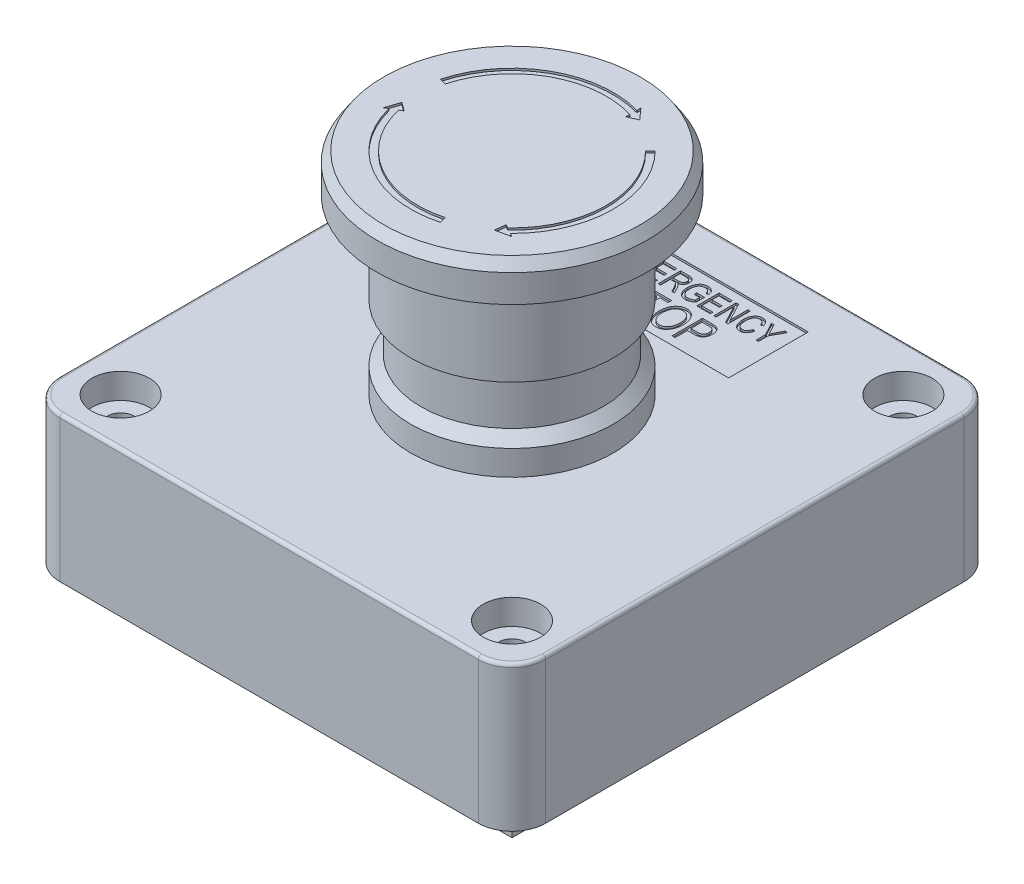
from build123d import *

# Parameters (mm, degrees)
SKETCH1_W               = 72
SKETCH1_H               = 72
BOSS_EXTRUDE1_DEPTH     = 21.5
FILLET1_R               = 5
CUT_EXTRUDE1_DEPTH      = 18.13
CUT_EXTRUDE2_DEPTH      = 56.265269383
CUT_EXTRUDE2_DEPTH_BACK = 56.265269383
SKETCH3_R               = 2
FILLET2_R               = 2
CUT_EXTRUDE3_DEPTH      = 56.265269383
CUT_EXTRUDE3_DEPTH_BACK = 0.3
SKETCH4_W               = 27.8
SKETCH4_H               = 11.8
CUT_EXTRUDE4_DEPTH      = 0.3
SKETCH8_R               = 4.25
CUT_EXTRUDE5_DEPTH      = 3.75
FILLET3_R               = 0.5
SKETCH9_R               = 12.5
BOSS_EXTRUDE2_DEPTH     = 10
BOSS_EXTRUDE3_DEPTH     = 6
SKETCH11_W              = 27
SKETCH11_H              = 27
BOSS_EXTRUDE4_DEPTH     = 24
CUT_EXTRUDE6_DEPTH      = 0.3


with BuildPart() as part:
    # Sketch1 → Boss-Extrude1 (new body)
    with BuildSketch(Plane(origin=(0, 0, 0), x_dir=(1, 0, 0), z_dir=(0, 1, 0))):
        Rectangle(SKETCH1_W, SKETCH1_H)
    extrude(amount=BOSS_EXTRUDE1_DEPTH)

    # Fillet1
    fillet1_edges = [part.edges().sort_by_distance(p)[0] for p in [
        (36, 10.75, 36),
        (-36, 10.75, 36),
        (-36, 10.75, -36),
        (36, 10.75, -36),
    ]]
    fillet(fillet1_edges, radius=FILLET1_R)

    # Sketch2 → Cut-Extrude1 (cut)
    with BuildSketch(Plane.XZ):
        Polygon((31, 12.3), (31, -16.4), (21.801694134, -26.5), (21.801694134, -31), (-21, -31), (-21, -13.290085662), (-31, -13.290085662), (-31, 15.409914338), (-20.9, 26.5), (-20.9, 31), (21, 31), (21, 12.3), align=None)
    extrude(amount=-CUT_EXTRUDE1_DEPTH, mode=Mode.SUBTRACT)

    # Sketch3 → Cut-Extrude2 (cut, two sides: drawn at the far end of the back side and taken through both)
    with BuildSketch(Plane(origin=(0, 21.5, 0), x_dir=(1, 0, 0), z_dir=(0, 1, 0)).offset(-CUT_EXTRUDE2_DEPTH_BACK)):
        with Locations(Location((-29, 29, 0), (0, 0, 270))):
            Circle(SKETCH3_R)
        with Locations(Location((29, 29, 0), (0, 0, 270))):
            Circle(SKETCH3_R)
        with Locations(Location((29, -29, 0), (0, 0, 270))):
            Circle(SKETCH3_R)
        with Locations(Location((-29, -29, 0), (0, 0, 270))):
            Circle(SKETCH3_R)
    extrude(amount=CUT_EXTRUDE2_DEPTH + CUT_EXTRUDE2_DEPTH_BACK, mode=Mode.SUBTRACT)

    # Fillet2
    fillet2_edges = [part.edges().sort_by_distance(p)[0] for p in [
        (21, 9.065, 12.3),
        (31, 9.065, 12.3),
        (31, 9.065, -16.4),
        (21.801694134, 9.065, -26.5),
        (21.801694134, 9.065, -31),
        (-21, 9.065, -31),
        (-21, 9.065, -13.290085662),
        (-31, 9.065, -13.290085662),
        (-31, 9.065, 15.409914338),
        (-20.9, 9.065, 26.5),
        (-20.9, 9.065, 31),
        (21, 9.065, 31),
    ]]
    fillet(fillet2_edges, radius=FILLET2_R)

    # Sketch4 → Cut-Extrude3 (cut, two sides: drawn at the far end of the back side and taken through both)
    with BuildSketch(Plane(origin=(0, 21.5, 0), x_dir=(1, 0, 0), z_dir=(0, 1, 0)).offset(-CUT_EXTRUDE3_DEPTH_BACK)):
        with Locations((0, 24.1)):
            Rectangle(SKETCH4_W, SKETCH4_H)
    extrude(amount=CUT_EXTRUDE3_DEPTH + CUT_EXTRUDE3_DEPTH_BACK, mode=Mode.SUBTRACT)

    # Sketch6 → Revolve2 (revolve)
    with BuildSketch(Plane.XY, mode=Mode.PRIVATE) as revolve2_sk:
        Polygon((0, 52.8), (0, 47.2), (15, 47.2), (20, 47.2), (20, 51.3), (19, 52.8), align=None)
        Polygon((0, 47.2), (0, 33.7), (13.5, 33.7), (15, 33.7), (15, 47.2), align=None)
        Polygon((0, 33.7), (0, 21.5), (15, 21.5), (15, 25.2), (13.5, 26.7), (13.5, 33.7), align=None)
    revolve(revolve2_sk.sketch.rotate(Axis((0, 0, 0), (0, 1, 0)), 90), axis=Axis((0, 0, 0), (0, 1, 0)))

    # Sketch7 → Cut-Extrude4 (cut)
    # profile 1 of 13: a face of its own
    with BuildSketch(Plane(origin=(0, 21.2, 0), x_dir=(1, 0, 0), z_dir=(0, 1, 0))):
        Polygon((-11.935714286, 25.386938867), (-11.935714286, 28.686938867), (-9.964285714, 28.686938867), (-9.964285714, 28.301224581), (-11.592857143, 28.301224581), (-11.592857143, 27.272653153), (-10.05, 27.272653153), (-10.05, 26.886938867), (-11.592857143, 26.886938867), (-11.592857143, 25.772653153), (-9.921428571, 25.772653153), (-9.921428571, 25.386938867), align=None)
    # profile 2 of 13: a face of its own
    with BuildSketch(Plane(origin=(0, 21.2, 0), x_dir=(1, 0, 0), z_dir=(0, 1, 0))):
        with BuildLine():
            Line((-9.407142857, 25.386938867), (-9.407142857, 28.686938867))
            Line((-9.407142857, 28.686938867), (-8.870758929, 28.686938867))
            Line((-8.870758929, 28.686938867), (-8.228571429, 26.350554938))
            Line((-8.228571429, 26.350554938), (-8.1, 25.861715653))
            add(Edge.make_bspline(
                [(-8.1, 25.861715653), (-8.09580599, 25.877799765), (-8.086993225, 25.911596892), (-8.072040154, 25.964887601), (-8.055168036, 26.023207661), (-8.038152733, 26.087058482), (-8.018507157, 26.155524866), (-7.996972068, 26.229089658), (-7.974241018, 26.308118688), (-7.958695008, 26.362605574), (-7.950669643, 26.39073351)],
                knots=[0, 0, 0, 0, 0.72569615, 1.52488642, 2.416426408, 3.376296137, 4.409732583, 5.526177123, 6.722930645, 8, 8, 8, 8], degree=3))
            Line((-7.950669643, 26.39073351), (-7.278348214, 28.686938867))
            Line((-7.278348214, 28.686938867), (-6.792857143, 28.686938867))
            Line((-6.792857143, 28.686938867), (-6.792857143, 25.386938867))
            Line((-6.792857143, 25.386938867), (-7.135714286, 25.386938867))
            Line((-7.135714286, 25.386938867), (-7.135714286, 28.11104601))
            Line((-7.135714286, 28.11104601), (-7.927901786, 25.386938867))
            Line((-7.927901786, 25.386938867), (-8.278794643, 25.386938867))
            Line((-8.278794643, 25.386938867), (-9.064285714, 28.267072795))
            Line((-9.064285714, 28.267072795), (-9.064285714, 25.386938867))
            Line((-9.064285714, 25.386938867), (-9.407142857, 25.386938867))
        make_face()
    # profile 3 of 13: a face of its own
    with BuildSketch(Plane(origin=(0, 21.2, 0), x_dir=(1, 0, 0), z_dir=(0, 1, 0))):
        Polygon((-6.235714286, 25.386938867), (-6.235714286, 28.686938867), (-4.264285714, 28.686938867), (-4.264285714, 28.301224581), (-5.892857143, 28.301224581), (-5.892857143, 27.272653153), (-4.35, 27.272653153), (-4.35, 26.886938867), (-5.892857143, 26.886938867), (-5.892857143, 25.772653153), (-4.221428571, 25.772653153), (-4.221428571, 25.386938867), align=None)
    # profile 4 of 13: a face of its own
    with BuildSketch(Plane(origin=(0, 21.2, 0), x_dir=(1, 0, 0), z_dir=(0, 1, 0))):
        with BuildLine():
            Line((-3.707142857, 25.386938867), (-3.707142857, 28.686938867))
            Line((-3.707142857, 28.686938867), (-2.495089286, 28.686938867))
            add(Edge.make_bspline(
                [(-2.495089286, 28.686938867), (-2.464501753, 28.686762801), (-2.405296434, 28.686422009), (-2.319528953, 28.68151951), (-2.239778603, 28.674262263), (-2.166151633, 28.664612953), (-2.099077856, 28.651235194), (-2.038291278, 28.635007012), (-1.983297374, 28.616892967), (-1.918736611, 28.587013686), (-1.845080961, 28.540667961), (-1.765643396, 28.470057906), (-1.696062565, 28.382616466), (-1.634145944, 28.282149706), (-1.583298101, 28.169349319), (-1.547280302, 28.046333646), (-1.525537065, 27.914718958), (-1.522821889, 27.8240774), (-1.521428571, 27.777563867)],
                knots=[0, 0, 0, 0, 0.957775898, 1.853873864, 2.6892683, 3.465319774, 4.178195347, 4.829309051, 5.435011313, 5.988660553, 7.053440284, 8.147710094, 9.30058322, 10.540256924, 11.835580405, 13.162637032, 14.543981594, 16, 16, 16, 16], degree=3))
            add(Edge.make_bspline(
                [(-1.521428571, 27.777563867), (-1.522157073, 27.74674054), (-1.523580063, 27.686532947), (-1.53220016, 27.598288282), (-1.547179898, 27.514583581), (-1.570088836, 27.435635435), (-1.596657587, 27.360462782), (-1.631545778, 27.290383354), (-1.671573329, 27.224492076), (-1.718096702, 27.163312675), (-1.770134804, 27.106981577), (-1.828536729, 27.056384235), (-1.892166907, 27.010802188), (-1.96152148, 26.970635671), (-2.036171216, 26.935370542), (-2.11699912, 26.907230465), (-2.202745471, 26.882587464), (-2.262389386, 26.871284276), (-2.292857143, 26.865510295)],
                knots=[0, 0, 0, 0, 1.121977975, 2.191573688, 3.224240956, 4.211948119, 5.180998842, 6.122125515, 7.055751929, 7.983633331, 8.914994346, 9.842128418, 10.791356962, 11.759862547, 12.75578979, 13.791489111, 14.871831714, 16, 16, 16, 16], degree=3))
            add(Edge.make_bspline(
                [(-2.292857143, 26.865510295), (-2.27036884, 26.853068063), (-2.227559839, 26.82938288), (-2.168974159, 26.791169106), (-2.118905971, 26.752705058), (-2.090601961, 26.724714292), (-2.077232143, 26.711492438)],
                knots=[0, 0, 0, 0, 1.158843086, 2.205987482, 3.152571606, 4, 4, 4, 4], degree=3))
            add(Edge.make_bspline(
                [(-2.077232143, 26.711492438), (-2.050490669, 26.679214406), (-1.996707016, 26.614295376), (-1.922978184, 26.510725204), (-1.852355677, 26.402983255), (-1.810882815, 26.327192348), (-1.789955357, 26.288947795)],
                knots=[0, 0, 0, 0, 0.982253192, 1.975551771, 2.978451105, 4, 4, 4, 4], degree=3))
            Line((-1.789955357, 26.288947795), (-1.307142857, 25.386938867))
            Line((-1.307142857, 25.386938867), (-1.696875, 25.386938867))
            Line((-1.696875, 25.386938867), (-2.077901786, 26.092742438))
            add(Edge.make_bspline(
                [(-2.077901786, 26.092742438), (-2.095651741, 26.125836639), (-2.129603168, 26.189137944), (-2.179990609, 26.279016463), (-2.226829263, 26.360073571), (-2.270040029, 26.432388323), (-2.310263275, 26.495193535), (-2.346389608, 26.549352239), (-2.379474614, 26.594247678), (-2.41907213, 26.640503539), (-2.465097809, 26.68845247), (-2.519811148, 26.736608226), (-2.574460942, 26.773939546), (-2.630101921, 26.802368554), (-2.691350689, 26.821096743), (-2.760365996, 26.835115033), (-2.840234942, 26.842739923), (-2.896860196, 26.843615529), (-2.927008929, 26.844081724)],
                knots=[0, 0, 0, 0, 1.483643366, 2.83785556, 4.070616892, 5.1822306, 6.165666296, 7.016844219, 7.754091418, 8.367230408, 9.421242841, 10.377779407, 11.241203819, 12.029974219, 12.835959019, 13.762973995, 14.808950166, 16, 16, 16, 16], degree=3))
            Line((-2.927008929, 26.844081724), (-3.364285714, 26.844081724))
            Line((-3.364285714, 26.844081724), (-3.364285714, 25.386938867))
            Line((-3.364285714, 25.386938867), (-3.707142857, 25.386938867))
        make_face()
        with BuildLine():
            Line((-3.364285714, 27.22979601), (-2.560044643, 27.22979601))
            add(Edge.make_bspline(
                [(-2.560044643, 27.22979601), (-2.518728517, 27.230600851), (-2.441298065, 27.232109203), (-2.332972886, 27.242126846), (-2.240514242, 27.260255003), (-2.162195096, 27.286657837), (-2.095411335, 27.321642485), (-2.037267321, 27.36496549), (-1.986267367, 27.416705634), (-1.942886459, 27.476552573), (-1.907017895, 27.543199354), (-1.882809512, 27.616463334), (-1.866377832, 27.694244172), (-1.864994442, 27.748010033), (-1.864285714, 27.775554938)],
                knots=[0, 0, 0, 0, 1.47306528, 2.760668081, 3.873497699, 4.82484281, 5.696997418, 6.550136397, 7.399890849, 8.276969651, 9.17766846, 10.086208714, 11.019541422, 12, 12, 12, 12], degree=3))
            add(Edge.make_bspline(
                [(-1.864285714, 27.775554938), (-1.864904699, 27.795434), (-1.866111427, 27.834188751), (-1.872460538, 27.890805742), (-1.884852127, 27.94408387), (-1.901202062, 27.994309438), (-1.923183601, 28.041023581), (-1.94885284, 28.084963685), (-1.981180283, 28.124323207), (-2.01636008, 28.16158492), (-2.057072873, 28.194664814), (-2.102538267, 28.223327798), (-2.152747097, 28.247405225), (-2.207217317, 28.268050622), (-2.267054473, 28.281783225), (-2.330856212, 28.293677123), (-2.399415651, 28.300271238), (-2.446639056, 28.300900305), (-2.470982143, 28.301224581)],
                knots=[0, 0, 0, 0, 1.045235731, 2.037714497, 2.988326782, 3.915852726, 4.808207886, 5.697550021, 6.58254782, 7.478674216, 8.387536059, 9.331464042, 10.296946822, 11.310355404, 12.385965615, 13.518246496, 14.720686494, 16, 16, 16, 16], degree=3))
            Line((-2.470982143, 28.301224581), (-3.364285714, 28.301224581))
            Line((-3.364285714, 28.301224581), (-3.364285714, 27.22979601))
        make_face(mode=Mode.SUBTRACT)
    # profile 5 of 13: a face of its own
    with BuildSketch(Plane(origin=(0, 21.2, 0), x_dir=(1, 0, 0), z_dir=(0, 1, 0))):
        with BuildLine():
            Line((0.321428571, 26.672653153), (0.321428571, 27.058367438))
            Line((0.321428571, 27.058367438), (1.478571429, 27.058367438))
            Line((1.478571429, 27.058367438), (1.478571429, 25.849662081))
            add(Edge.make_bspline(
                [(1.478571429, 25.849662081), (1.434566319, 25.809618699), (1.34844129, 25.731247405), (1.211176997, 25.62892434), (1.072205304, 25.540970046), (0.930778697, 25.469108967), (0.787151572, 25.412668127), (0.641414883, 25.37326008), (0.493458598, 25.348810078), (0.394065373, 25.345661481), (0.344196429, 25.344081724)],
                knots=[0, 0, 0, 0, 1.121144615, 2.194259096, 3.22291754, 4.218514423, 5.180530362, 6.126881594, 7.060193117, 8, 8, 8, 8], degree=3))
            add(Edge.make_bspline(
                [(0.344196429, 25.344081724), (0.311369437, 25.344844682), (0.246273277, 25.346357632), (0.149986288, 25.354779277), (0.056307974, 25.370513135), (-0.034569605, 25.391767634), (-0.122922923, 25.419120882), (-0.207978794, 25.453936757), (-0.291324343, 25.492847018), (-0.371005382, 25.53944554), (-0.447318379, 25.591589963), (-0.519760078, 25.64940555), (-0.588473512, 25.712302598), (-0.652212066, 25.781959928), (-0.712142908, 25.856829191), (-0.769024991, 25.936657995), (-0.820260228, 26.0230928), (-0.868714682, 26.11434823), (-0.911309802, 26.211298618), (-0.948322934, 26.313108942), (-0.979599264, 26.419618496), (-1.005836365, 26.530889376), (-1.025880188, 26.646956789), (-1.039561379, 26.767707305), (-1.048724436, 26.893047062), (-1.049569944, 26.978216668), (-1.05, 27.021537081)],
                knots=[0, 0, 0, 0, 0.963545397, 1.910717405, 2.833679837, 3.748938136, 4.648160849, 5.544707014, 6.44428759, 7.345417256, 8.250301349, 9.15471106, 10.063381295, 10.981308332, 11.922549023, 12.876762963, 13.855312354, 14.869185747, 15.907484256, 16.960251447, 18.046404778, 19.163470092, 20.313696906, 21.500864286, 22.728847097, 24, 24, 24, 24], degree=3))
            add(Edge.make_bspline(
                [(-1.05, 27.021537081), (-1.049551802, 27.065525007), (-1.048670412, 27.152028261), (-1.039741595, 27.279648488), (-1.025071261, 27.402771128), (-1.004869581, 27.521641273), (-0.979886467, 27.636563658), (-0.947434996, 27.746842107), (-0.910106927, 27.85290887), (-0.867036648, 27.954044305), (-0.819986506, 28.050156926), (-0.76824526, 28.139884843), (-0.713538378, 28.223497297), (-0.654135732, 28.299621122), (-0.592799106, 28.370656649), (-0.526899742, 28.434202556), (-0.457761799, 28.491686727), (-0.384384281, 28.541796399), (-0.30788955, 28.586250786), (-0.2277834, 28.624346964), (-0.14466263, 28.657325319), (-0.058107099, 28.68432925), (0.032062046, 28.704065968), (0.125523763, 28.718732707), (0.222332027, 28.728647392), (0.288144851, 28.729410222), (0.321428571, 28.72979601)],
                knots=[0, 0, 0, 0, 1.283121513, 2.523287582, 3.730023389, 4.899079804, 6.039789461, 7.15880579, 8.250410031, 9.318392136, 10.363902253, 11.370311636, 12.338384822, 13.276198214, 14.185288112, 15.074093801, 15.943727649, 16.805327304, 17.663128848, 18.522362821, 19.39060582, 20.270106898, 21.164311373, 22.080741752, 23.02936765, 24, 24, 24, 24], degree=3))
            add(Edge.make_bspline(
                [(0.321428571, 28.72979601), (0.369945799, 28.728641781), (0.464327604, 28.726396431), (0.601165087, 28.705195561), (0.728797889, 28.670680732), (0.846737386, 28.621354408), (0.955004923, 28.559516736), (1.053571683, 28.486039319), (1.142166212, 28.400936624), (1.206953542, 28.32015278), (1.253910692, 28.249494112), (1.28691251, 28.191271767), (1.317661975, 28.128481247), (1.345602993, 28.060556409), (1.37167504, 27.988144166), (1.395873332, 27.911145793), (1.417177395, 27.829272972), (1.429438934, 27.772921784), (1.435714286, 27.744081724)],
                knots=[0, 0, 0, 0, 1.421442541, 2.765168547, 4.047841273, 5.288586259, 6.501956771, 7.694182091, 8.88353085, 10.093491299, 10.721426975, 11.369099503, 12.053886711, 12.769643166, 13.521004755, 14.309514717, 15.134823968, 16, 16, 16, 16], degree=3))
            Line((1.435714286, 27.744081724), (1.092857143, 27.658367438))
            add(Edge.make_bspline(
                [(1.092857143, 27.658367438), (1.081663277, 27.700520147), (1.060588963, 27.779879635), (1.021233113, 27.889224277), (0.977413784, 27.981689332), (0.928422408, 28.059194605), (0.872134588, 28.123713319), (0.809789334, 28.180812898), (0.737807505, 28.228545784), (0.659668681, 28.270545669), (0.57443793, 28.302811733), (0.484183709, 28.327399965), (0.388389598, 28.341483937), (0.322812941, 28.343202883), (0.289285714, 28.344081724)],
                knots=[0, 0, 0, 0, 1.35370667, 2.548578037, 3.602482135, 4.525244969, 5.385205021, 6.25372376, 7.141792941, 8.059466754, 9.00287123, 9.96447941, 10.959304047, 12, 12, 12, 12], degree=3))
            add(Edge.make_bspline(
                [(0.289285714, 28.344081724), (0.264716113, 28.34375971), (0.216374066, 28.34312613), (0.144999281, 28.336203133), (0.076322127, 28.324951184), (0.010193047, 28.309237964), (-0.053565714, 28.290496671), (-0.114047953, 28.264968803), (-0.172356353, 28.23640404), (-0.228239617, 28.203477555), (-0.281542004, 28.165874656), (-0.331632661, 28.122731841), (-0.379409596, 28.075317572), (-0.423689773, 28.022125983), (-0.466624463, 27.965114054), (-0.505973251, 27.902371583), (-0.5430332, 27.83515306), (-0.576872156, 27.763076094), (-0.607905988, 27.686540041), (-0.634606088, 27.605803463), (-0.656428644, 27.520663088), (-0.675570818, 27.431862127), (-0.688993635, 27.338497244), (-0.700187132, 27.241187599), (-0.705952314, 27.139688083), (-0.706741957, 27.070650092), (-0.707142857, 27.035599581)],
                knots=[0, 0, 0, 0, 0.95244652, 1.873991161, 2.777557121, 3.648832578, 4.508552549, 5.350797697, 6.190771618, 7.02501797, 7.86316154, 8.7165405, 9.585620601, 10.469996113, 11.397859992, 12.351132043, 13.338946381, 14.372712626, 15.436726846, 16.539770861, 17.66713286, 18.84353329, 20.060284837, 21.322933361, 22.640856277, 24, 24, 24, 24], degree=3))
            add(Edge.make_bspline(
                [(-0.707142857, 27.035599581), (-0.706256535, 26.982889767), (-0.704537199, 26.880640413), (-0.690924145, 26.732328885), (-0.669393261, 26.593868454), (-0.638027249, 26.465704838), (-0.597870114, 26.347730767), (-0.549084942, 26.23972531), (-0.490780039, 26.142100661), (-0.423339259, 26.055258152), (-0.34879641, 25.97890816), (-0.268756909, 25.912145355), (-0.183418779, 25.855301343), (-0.092054482, 25.80982985), (0.003994918, 25.773150441), (0.105832292, 25.747827549), (0.212958284, 25.733068936), (0.286114266, 25.730901704), (0.3234375, 25.72979601)],
                knots=[0, 0, 0, 0, 1.344305217, 2.607756079, 3.795613497, 4.915552292, 5.968887625, 6.970219091, 7.933010886, 8.862341374, 9.768284732, 10.649651063, 11.516609893, 12.377263757, 13.247581458, 14.134137142, 15.048060964, 16, 16, 16, 16], degree=3))
            add(Edge.make_bspline(
                [(0.3234375, 25.72979601), (0.360118855, 25.730953363), (0.43461704, 25.733303895), (0.546676816, 25.752932231), (0.659764189, 25.784835664), (0.771645201, 25.827854747), (0.878282884, 25.879283066), (0.975994975, 25.93585047), (1.061833996, 25.998021128), (1.111599211, 26.044684175), (1.135714286, 26.06729601)],
                knots=[0, 0, 0, 0, 0.978162575, 1.986604247, 3.025534994, 4.109442341, 5.180230685, 6.181206173, 7.118654505, 8, 8, 8, 8], degree=3))
            Line((1.135714286, 26.06729601), (1.135714286, 26.672653153))
            Line((1.135714286, 26.672653153), (0.321428571, 26.672653153))
        make_face()
    # profile 6 of 13: a face of its own
    with BuildSketch(Plane(origin=(0, 21.2, 0), x_dir=(1, 0, 0), z_dir=(0, 1, 0))):
        Polygon((1.992857143, 25.386938867), (1.992857143, 28.686938867), (3.964285714, 28.686938867), (3.964285714, 28.301224581), (2.335714286, 28.301224581), (2.335714286, 27.272653153), (3.878571429, 27.272653153), (3.878571429, 26.886938867), (2.335714286, 26.886938867), (2.335714286, 25.772653153), (4.007142857, 25.772653153), (4.007142857, 25.386938867), align=None)
    # profile 7 of 13: a face of its own
    with BuildSketch(Plane(origin=(0, 21.2, 0), x_dir=(1, 0, 0), z_dir=(0, 1, 0))):
        Polygon((4.521428571, 25.386938867), (4.521428571, 28.686938867), (4.886383929, 28.686938867), (6.278571429, 26.056581724), (6.278571429, 28.686938867), (6.621428571, 28.686938867), (6.621428571, 25.386938867), (6.254464286, 25.386938867), (4.864285714, 28.013947795), (4.864285714, 25.386938867), align=None)
    # profile 8 of 13: a face of its own
    with BuildSketch(Plane(origin=(0, 21.2, 0), x_dir=(1, 0, 0), z_dir=(0, 1, 0))):
        with BuildLine():
            Line((9.192857143, 26.544081724), (9.535714286, 26.458367438))
            add(Edge.make_bspline(
                [(9.535714286, 26.458367438), (9.52549537, 26.412932574), (9.505572747, 26.324353542), (9.468204483, 26.196947956), (9.424538841, 26.078705678), (9.375771571, 25.969178759), (9.32151162, 25.868350399), (9.262026078, 25.776289952), (9.196814212, 25.693072665), (9.125551197, 25.619723293), (9.050615912, 25.553909478), (8.970262967, 25.498665172), (8.886909824, 25.450248595), (8.798963885, 25.411686883), (8.707312836, 25.3811442), (8.611463266, 25.360074427), (8.511804617, 25.345955094), (8.443799689, 25.344711329), (8.409375, 25.344081724)],
                knots=[0, 0, 0, 0, 1.289221957, 2.51344498, 3.673011535, 4.776835723, 5.830430132, 6.840130389, 7.808269491, 8.7523986, 9.668123701, 10.564817631, 11.447926293, 12.333367568, 13.218722559, 14.118350969, 15.047492789, 16, 16, 16, 16], degree=3))
            add(Edge.make_bspline(
                [(8.409375, 25.344081724), (8.378992332, 25.34450096), (8.319435172, 25.345322762), (8.231788601, 25.354612744), (8.147300841, 25.36818249), (8.066167497, 25.388612036), (7.988209839, 25.413621928), (7.914180549, 25.445741903), (7.842876716, 25.482296634), (7.775114461, 25.525496854), (7.710088717, 25.57443712), (7.649544583, 25.631340328), (7.59055347, 25.69354201), (7.536138391, 25.764014369), (7.482605617, 25.839947773), (7.434478917, 25.924181361), (7.387790276, 26.014250759), (7.344793876, 26.110880196), (7.304745601, 26.213097983), (7.272041026, 26.321055883), (7.242872241, 26.432874997), (7.219722428, 26.549421987), (7.200621858, 26.670212645), (7.188526254, 26.795902547), (7.179977316, 26.925883206), (7.179045298, 27.014156184), (7.178571429, 27.059037081)],
                knots=[0, 0, 0, 0, 0.921095259, 1.805562833, 2.670327692, 3.514278933, 4.340642213, 5.150451062, 5.958900505, 6.768369716, 7.58482939, 8.423223242, 9.285360719, 10.181948201, 11.120907027, 12.10087379, 13.121233649, 14.196976745, 15.307105309, 16.44839936, 17.61583717, 18.810746038, 20.050660639, 21.323136918, 22.638994396, 24, 24, 24, 24], degree=3))
            add(Edge.make_bspline(
                [(7.178571429, 27.059037081), (7.179041428, 27.103248777), (7.179963244, 27.189961698), (7.188498184, 27.317266971), (7.20056301, 27.439624188), (7.219730879, 27.556613388), (7.242722333, 27.668743638), (7.271782236, 27.775268696), (7.3049762, 27.877064945), (7.34444781, 27.973158881), (7.388927224, 28.06362708), (7.436457203, 28.148845982), (7.487147923, 28.228823318), (7.542159634, 28.302739801), (7.601198642, 28.370411896), (7.663785772, 28.432517294), (7.730246022, 28.488669721), (7.799810392, 28.539885263), (7.872707497, 28.584273385), (7.947433913, 28.623692521), (8.024551793, 28.656399779), (8.103779694, 28.683276708), (8.185041037, 28.70416892), (8.26836644, 28.718533328), (8.353546062, 28.728664898), (8.41113042, 28.729416745), (8.440178571, 28.72979601)],
                knots=[0, 0, 0, 0, 1.355009242, 2.657595594, 3.909622363, 5.12221665, 6.289669639, 7.416642245, 8.504963989, 9.569716403, 10.597874851, 11.593392335, 12.559484071, 13.498222117, 14.414780627, 15.309839368, 16.198178116, 17.079506653, 17.954919271, 18.811820418, 19.667108407, 20.519600343, 21.37423126, 22.235899437, 23.110108003, 24, 24, 24, 24], degree=3))
            add(Edge.make_bspline(
                [(8.440178571, 28.72979601), (8.471903336, 28.728974662), (8.534221541, 28.727361256), (8.626268406, 28.716062948), (8.714321557, 28.695513969), (8.799862169, 28.669039995), (8.881284984, 28.633251769), (8.959642023, 28.590195881), (9.034249863, 28.538964827), (9.105157221, 28.479874163), (9.172287111, 28.413655331), (9.234118937, 28.339614645), (9.290088245, 28.258080362), (9.342370216, 28.170194092), (9.387400129, 28.073813729), (9.428000652, 27.970634211), (9.464966451, 27.860479355), (9.483404132, 27.78353245), (9.492857143, 27.744081724)],
                knots=[0, 0, 0, 0, 0.969230344, 1.90389736, 2.827024372, 3.728538081, 4.635631584, 5.539103428, 6.456494714, 7.396000419, 8.355610671, 9.333534695, 10.338037519, 11.374284513, 12.454112223, 13.583699076, 14.761161004, 16, 16, 16, 16], degree=3))
            Line((9.492857143, 27.744081724), (9.15, 27.658367438))
            add(Edge.make_bspline(
                [(9.15, 27.658367438), (9.14225073, 27.686132916), (9.127137326, 27.740283942), (9.100242594, 27.81806132), (9.070827158, 27.890528276), (9.03885824, 27.957880457), (9.003258258, 28.019533417), (8.965067704, 28.075989573), (8.924221212, 28.127406092), (8.879860829, 28.172698811), (8.833462932, 28.213565497), (8.783605743, 28.248574177), (8.730703221, 28.27782069), (8.675233416, 28.302405944), (8.617021037, 28.320898441), (8.555874669, 28.334519524), (8.491956837, 28.342553935), (8.448236664, 28.343568431), (8.426116071, 28.344081724)],
                knots=[0, 0, 0, 0, 1.274827499, 2.486296693, 3.637698816, 4.732866786, 5.781146847, 6.783409552, 7.745577291, 8.681189198, 9.583979081, 10.476943643, 11.369744444, 12.253932728, 13.156290603, 14.066553906, 15.021756508, 16, 16, 16, 16], degree=3))
            add(Edge.make_bspline(
                [(8.426116071, 28.344081724), (8.382454387, 28.342464102), (8.297255233, 28.339307559), (8.174031438, 28.313050992), (8.059378655, 28.271052609), (7.97211589, 28.220657099), (7.907415736, 28.172320267), (7.861555132, 28.130995988), (7.818373363, 28.084862665), (7.777344743, 28.034359615), (7.738480242, 27.97907376), (7.703432674, 27.91833205), (7.669442765, 27.853857713), (7.638814225, 27.784274484), (7.611528313, 27.709964981), (7.587259124, 27.631090018), (7.566560135, 27.547510004), (7.549863347, 27.45897054), (7.537448748, 27.365721962), (7.527877163, 27.267687563), (7.522737615, 27.164895875), (7.521870274, 27.094756401), (7.521428571, 27.059037081)],
                knots=[0, 0, 0, 0, 1.477189771, 2.882511776, 4.245778241, 5.596752156, 6.277022015, 6.978177212, 7.684002091, 8.414723124, 9.180080371, 9.969542299, 10.787683758, 11.647234596, 12.541638645, 13.466905688, 14.440346501, 15.45581228, 16.516221105, 17.624831929, 18.790418795, 20, 20, 20, 20], degree=3))
            add(Edge.make_bspline(
                [(7.521428571, 27.059037081), (7.522275521, 27.005448853), (7.523918241, 26.90151053), (7.534392864, 26.750558179), (7.552718812, 26.609779795), (7.579621322, 26.479644673), (7.612851632, 26.35973405), (7.653281448, 26.250002059), (7.702443294, 26.150909395), (7.758608359, 26.062249925), (7.821275335, 25.984087635), (7.888889215, 25.915987302), (7.961876724, 25.858644667), (8.039351388, 25.810965902), (8.122466775, 25.77490234), (8.21005587, 25.748522473), (8.302790489, 25.732873676), (8.366234825, 25.730836959), (8.398660714, 25.72979601)],
                knots=[0, 0, 0, 0, 1.437104972, 2.787371166, 4.055570009, 5.241294904, 6.348053785, 7.389870239, 8.372351441, 9.308936623, 10.198930124, 11.053953419, 11.87666206, 12.682560998, 13.486679433, 14.299132302, 15.130700221, 16, 16, 16, 16], degree=3))
            add(Edge.make_bspline(
                [(8.398660714, 25.72979601), (8.422800611, 25.730459932), (8.470370914, 25.731768263), (8.540502572, 25.741541226), (8.608338584, 25.756653057), (8.673707061, 25.778831856), (8.735903982, 25.808065044), (8.796184409, 25.84210006), (8.853302952, 25.883574022), (8.908058276, 25.930758285), (8.959324117, 25.984724735), (9.006190233, 26.045416791), (9.049363637, 26.112339854), (9.086400833, 26.186599972), (9.120079887, 26.266641), (9.149479833, 26.353200716), (9.174299398, 26.446278628), (9.186571754, 26.510956444), (9.192857143, 26.544081724)],
                knots=[0, 0, 0, 0, 0.928044623, 1.828813311, 2.717973564, 3.597468745, 4.476963925, 5.35746386, 6.25552913, 7.186585864, 8.133765821, 9.112470931, 10.131597503, 11.191133367, 12.299110282, 13.469062082, 14.703759174, 16, 16, 16, 16], degree=3))
        make_face()
    # profile 9 of 13: a face of its own
    with BuildSketch(Plane(origin=(0, 21.2, 0), x_dir=(1, 0, 0), z_dir=(0, 1, 0))):
        with BuildLine():
            Line((10.778571429, 25.386938867), (10.778571429, 26.785153153))
            Line((10.778571429, 26.785153153), (9.75, 28.686938867))
            Line((9.75, 28.686938867), (10.134375, 28.686938867))
            Line((10.134375, 28.686938867), (10.686830357, 27.691179938))
            add(Edge.make_bspline(
                [(10.686830357, 27.691179938), (10.713580656, 27.642843806), (10.766100709, 27.547943326), (10.840360332, 27.406243976), (10.910223658, 27.268711391), (10.953543567, 27.177436239), (10.974776786, 27.132697795)],
                knots=[0, 0, 0, 0, 1.054805564, 2.070946718, 3.054476075, 4, 4, 4, 4], degree=3))
            add(Edge.make_bspline(
                [(10.974776786, 27.132697795), (10.994908684, 27.177424098), (11.036473316, 27.269766724), (11.104568045, 27.411430591), (11.179563472, 27.561002559), (11.232267891, 27.663328243), (11.259375, 27.715956724)],
                knots=[0, 0, 0, 0, 0.906747811, 1.872085736, 2.905564156, 4, 4, 4, 4], degree=3))
            Line((11.259375, 27.715956724), (11.766294643, 28.686938867))
            Line((11.766294643, 28.686938867), (12.15, 28.686938867))
            Line((12.15, 28.686938867), (11.121428571, 26.785153153))
            Line((11.121428571, 26.785153153), (11.121428571, 25.386938867))
            Line((11.121428571, 25.386938867), (10.778571429, 25.386938867))
        make_face()
    # profile 10 of 13: a face of its own
    with BuildSketch(Plane(origin=(0, 21.2, 0), x_dir=(1, 0, 0), z_dir=(0, 1, 0))):
        with BuildLine():
            Line((-6.75, 21.177717651), (-6.282467532, 21.23615921))
            add(Edge.make_bspline(
                [(-6.282467532, 21.23615921), (-6.275659987, 21.176638545), (-6.262749425, 21.063757149), (-6.22738956, 20.905676484), (-6.180095629, 20.768336879), (-6.121667068, 20.648971518), (-6.046791525, 20.547790095), (-5.961264354, 20.456794314), (-5.860525619, 20.377408273), (-5.747758206, 20.308103775), (-5.623639483, 20.252169407), (-5.490474482, 20.213520341), (-5.350142976, 20.188783725), (-5.254063625, 20.185757868), (-5.204951299, 20.184211158)],
                knots=[0, 0, 0, 0, 1.28056062, 2.428593037, 3.455857635, 4.381585452, 5.257863862, 6.137303782, 7.045121912, 7.991827123, 8.962072888, 9.946560163, 10.950355038, 12, 12, 12, 12], degree=3))
            add(Edge.make_bspline(
                [(-5.204951299, 20.184211158), (-5.169918304, 20.18492309), (-5.101834534, 20.186306673), (-5.002696685, 20.196713188), (-4.909319052, 20.212389382), (-4.822579725, 20.236776963), (-4.740866211, 20.2652957), (-4.666478853, 20.303316718), (-4.596868247, 20.346285965), (-4.534056077, 20.396313578), (-4.478669527, 20.452542977), (-4.42846545, 20.511555604), (-4.387645729, 20.576159912), (-4.353225333, 20.643808611), (-4.327983549, 20.71616709), (-4.308405322, 20.791794507), (-4.297490518, 20.872104064), (-4.29614384, 20.926874871), (-4.295454545, 20.95490921)],
                knots=[0, 0, 0, 0, 1.25000475, 2.42928239, 3.554432982, 4.624373226, 5.641561959, 6.637472043, 7.59895824, 8.557494333, 9.494616268, 10.412591127, 11.316575992, 12.215324116, 13.115580924, 14.045624415, 14.999656403, 16, 16, 16, 16], degree=3))
            add(Edge.make_bspline(
                [(-4.295454545, 20.95490921), (-4.296459628, 20.987242582), (-4.298417285, 21.050220137), (-4.31508018, 21.141898759), (-4.343491233, 21.226858058), (-4.382168866, 21.305748405), (-4.432121897, 21.377936263), (-4.493812311, 21.443068398), (-4.567116681, 21.500641896), (-4.63706313, 21.54430472), (-4.704632547, 21.576106954), (-4.768470747, 21.603520085), (-4.84535224, 21.632436389), (-4.935152461, 21.66355949), (-5.037899843, 21.695983052), (-5.153651008, 21.730723828), (-5.282001367, 21.768237272), (-5.37232348, 21.793012564), (-5.419541396, 21.805964404)],
                knots=[0, 0, 0, 0, 1.005239862, 1.957963033, 2.886140254, 3.783827184, 4.682063204, 5.60636897, 6.563082868, 7.574767638, 8.163399764, 8.884479363, 9.735568196, 10.717712603, 11.840607427, 13.08667948, 14.476996158, 16, 16, 16, 16], degree=3))
            add(Edge.make_bspline(
                [(-5.419541396, 21.805964404), (-5.461916293, 21.817920489), (-5.54357925, 21.840961706), (-5.660686116, 21.877836619), (-5.768558125, 21.913630454), (-5.866530359, 21.951818525), (-5.955833236, 21.988086056), (-6.0347087, 22.027006556), (-6.104364662, 22.065116115), (-6.184472211, 22.11567316), (-6.271969095, 22.18638195), (-6.364703665, 22.280865494), (-6.445713304, 22.385487032), (-6.51330132, 22.500237422), (-6.568118357, 22.623707679), (-6.604416522, 22.756799687), (-6.629733104, 22.896825765), (-6.631974774, 22.993244322), (-6.633116883, 23.042368625)],
                knots=[0, 0, 0, 0, 1.113815205, 2.146493548, 3.105946624, 3.988323839, 4.806360381, 5.543364066, 6.212027532, 6.814445107, 7.937696897, 9.048553401, 10.157540001, 11.276136463, 12.410655589, 13.563606105, 14.758681343, 16, 16, 16, 16], degree=3))
            add(Edge.make_bspline(
                [(-6.633116883, 23.042368625), (-6.632109082, 23.086559398), (-6.630127948, 23.173429552), (-6.613215414, 23.300575221), (-6.586407834, 23.421973638), (-6.546405603, 23.536328191), (-6.497464701, 23.645267517), (-6.43548588, 23.746605039), (-6.363817636, 23.842769225), (-6.280842326, 23.931474391), (-6.189451725, 24.012826327), (-6.088600358, 24.082748714), (-5.980417149, 24.142001021), (-5.864879486, 24.192063874), (-5.740925156, 24.229082464), (-5.609732437, 24.255139659), (-5.471126152, 24.272262687), (-5.376067326, 24.274151506), (-5.327313312, 24.275120248)],
                knots=[0, 0, 0, 0, 1.048547399, 2.061232895, 3.039277619, 3.994368589, 4.931972946, 5.868741773, 6.808014961, 7.774272834, 8.746911737, 9.706990873, 10.680354074, 11.670809819, 12.690200298, 13.744432806, 14.843158913, 16, 16, 16, 16], degree=3))
            add(Edge.make_bspline(
                [(-5.327313312, 24.275120248), (-5.260845391, 24.273264621), (-5.131149013, 24.269643804), (-4.943015763, 24.239361462), (-4.767814686, 24.188059429), (-4.60621182, 24.116671749), (-4.459468883, 24.026549717), (-4.330102782, 23.917146791), (-4.217242767, 23.79090975), (-4.123354031, 23.646480334), (-4.047363977, 23.487160718), (-3.991719781, 23.31365591), (-3.955443156, 23.126897511), (-3.948416974, 22.997487224), (-3.944805195, 22.930964404)],
                knots=[0, 0, 0, 0, 1.10297814, 2.152200164, 3.153123011, 4.125894755, 5.076644034, 6.001845166, 6.928824672, 7.877651763, 8.851800581, 9.850539915, 10.895078977, 12, 12, 12, 12], degree=3))
            Line((-3.944805195, 22.930964404), (-4.412337662, 22.872522846))
            add(Edge.make_bspline(
                [(-4.412337662, 22.872522846), (-4.415767378, 22.908508302), (-4.422455587, 22.978682721), (-4.440935203, 23.07963218), (-4.464554482, 23.173754474), (-4.494167023, 23.260534982), (-4.53137699, 23.339652315), (-4.572805677, 23.41200639), (-4.621060996, 23.47684957), (-4.674899222, 23.53453781), (-4.734911318, 23.585056129), (-4.800293993, 23.629333924), (-4.871603143, 23.666838451), (-4.94896556, 23.696730816), (-5.031374383, 23.720783113), (-5.119832509, 23.73677957), (-5.213843301, 23.746999232), (-5.278584072, 23.748418352), (-5.311789773, 23.749146223)],
                knots=[0, 0, 0, 0, 1.225165016, 2.389166377, 3.475498799, 4.513395989, 5.492249234, 6.435697439, 7.335638185, 8.226419293, 9.105162265, 9.989643781, 10.899061877, 11.830466535, 12.797276613, 13.805291738, 14.874328703, 16, 16, 16, 16], degree=3))
            add(Edge.make_bspline(
                [(-5.311789773, 23.749146223), (-5.345612161, 23.748856529), (-5.410986236, 23.74829659), (-5.506068207, 23.737251289), (-5.595103145, 23.722664048), (-5.678211891, 23.700450503), (-5.754678256, 23.672416461), (-5.825566062, 23.63818711), (-5.889912575, 23.597447936), (-5.94806624, 23.550474477), (-5.998994846, 23.498242178), (-6.043797896, 23.442692631), (-6.08211276, 23.383611086), (-6.11197539, 23.320106135), (-6.135824317, 23.25312207), (-6.153351794, 23.182523905), (-6.163334232, 23.108096301), (-6.164824379, 23.057312615), (-6.165584416, 23.031410833)],
                knots=[0, 0, 0, 0, 1.28677749, 2.487165856, 3.639785246, 4.719183444, 5.756778416, 6.736320351, 7.710431992, 8.649732596, 9.575714218, 10.482424581, 11.363216052, 12.249555033, 13.147559346, 14.066626488, 15.013899474, 16, 16, 16, 16], degree=3))
            add(Edge.make_bspline(
                [(-6.165584416, 23.031410833), (-6.164035251, 22.984981684), (-6.161089588, 22.896698814), (-6.133550667, 22.772333485), (-6.087712118, 22.663326153), (-6.041221618, 22.603828588), (-6.01856737, 22.574836158)],
                knots=[0, 0, 0, 0, 1.135097977, 2.158336086, 3.102579849, 4, 4, 4, 4], degree=3))
            add(Edge.make_bspline(
                [(-6.01856737, 22.574836158), (-6.004657576, 22.560965556), (-5.974446226, 22.53083933), (-5.916260201, 22.492883464), (-5.846998847, 22.452952639), (-5.763063396, 22.416736761), (-5.667512882, 22.378763397), (-5.557934806, 22.343949076), (-5.435718951, 22.307927769), (-5.349020534, 22.286536773), (-5.303571429, 22.275323171)],
                knots=[0, 0, 0, 0, 0.600125557, 1.303441474, 2.117395318, 3.047759802, 4.098473224, 5.265768101, 6.566659033, 8, 8, 8, 8], degree=3))
            add(Edge.make_bspline(
                [(-5.303571429, 22.275323171), (-5.258788506, 22.264519335), (-5.172738185, 22.24375978), (-5.049335227, 22.211382523), (-4.935967586, 22.181455243), (-4.832803647, 22.152793316), (-4.74055975, 22.123137398), (-4.658421216, 22.095642987), (-4.585920956, 22.071090484), (-4.542207468, 22.052167377), (-4.521915584, 22.043383235)],
                knots=[0, 0, 0, 0, 1.354590389, 2.602843464, 3.751324185, 4.802492375, 5.750771121, 6.599881396, 7.350062303, 8, 8, 8, 8], degree=3))
            add(Edge.make_bspline(
                [(-4.521915584, 22.043383235), (-4.467173586, 22.01690547), (-4.361038612, 21.965569804), (-4.219555664, 21.86494345), (-4.098379735, 21.750604043), (-3.999776557, 21.620016063), (-3.921954042, 21.476056293), (-3.867442004, 21.318155413), (-3.833706829, 21.147489958), (-3.829886094, 21.02934027), (-3.827922078, 20.96860645)],
                knots=[0, 0, 0, 0, 1.070280572, 2.075083192, 3.046573603, 3.996247495, 4.946860593, 5.919165523, 6.930365132, 8, 8, 8, 8], degree=3))
            add(Edge.make_bspline(
                [(-3.827922078, 20.96860645), (-3.829908123, 20.907570786), (-3.833832366, 20.786969931), (-3.868662217, 20.610565049), (-3.925570622, 20.442456608), (-4.005170048, 20.285373542), (-4.102582462, 20.140750972), (-4.21721571, 20.012460073), (-4.349581273, 19.903638525), (-4.497821091, 19.813781311), (-4.661945722, 19.742484131), (-4.842660872, 19.694440749), (-5.038597953, 19.663336864), (-5.174689786, 19.659976454), (-5.24512987, 19.658237132)],
                knots=[0, 0, 0, 0, 1.011281659, 1.998199493, 2.968653118, 3.946038549, 4.909179922, 5.852720419, 6.788493457, 7.73981833, 8.718701351, 9.744837575, 10.832745308, 12, 12, 12, 12], degree=3))
            add(Edge.make_bspline(
                [(-5.24512987, 19.658237132), (-5.300585541, 19.65939998), (-5.408800035, 19.661669127), (-5.566507165, 19.681208237), (-5.715435074, 19.712999467), (-5.855915471, 19.757801798), (-5.988159938, 19.815552512), (-6.112023617, 19.885989534), (-6.226891717, 19.969602426), (-6.331859771, 20.065805311), (-6.426786442, 20.172543816), (-6.510431882, 20.288926675), (-6.581186163, 20.415233761), (-6.639128199, 20.550435112), (-6.686254558, 20.694288392), (-6.720715494, 20.847117921), (-6.74274384, 21.009401572), (-6.747543231, 21.120729687), (-6.75, 21.177717651)],
                knots=[0, 0, 0, 0, 1.104995383, 2.156254069, 3.161771291, 4.136451373, 5.090038804, 6.032932257, 6.970972664, 7.915738022, 8.865457713, 9.813334699, 10.766787024, 11.745048075, 12.740780621, 13.779854267, 14.863525297, 16, 16, 16, 16], degree=3))
        make_face()
    # profile 11 of 13: a face of its own
    with BuildSketch(Plane(origin=(0, 21.2, 0), x_dir=(1, 0, 0), z_dir=(0, 1, 0))):
        Polygon((-2.25, 19.71667869), (-2.25, 23.690704664), (-3.477272727, 23.690704664), (-3.477272727, 24.21667869), (-0.555194805, 24.21667869), (-0.555194805, 23.690704664), (-1.782467532, 23.690704664), (-1.782467532, 19.71667869), align=None)
    # profile 12 of 13: a face of its own
    with BuildSketch(Plane(origin=(0, 21.2, 0), x_dir=(1, 0, 0), z_dir=(0, 1, 0))):
        with BuildLine():
            add(Edge.make_bspline(
                [(-0.146103896, 21.907323982), (-0.144514423, 21.99960073), (-0.141419131, 22.179297603), (-0.117824726, 22.440560615), (-0.077744969, 22.685302686), (-0.022698549, 22.913758752), (0.049626663, 23.125518024), (0.137080476, 23.321402625), (0.241551196, 23.50050032), (0.361511526, 23.662025899), (0.492367677, 23.806275159), (0.633228089, 23.931300126), (0.781126796, 24.038217039), (0.937897127, 24.12420733), (1.101520593, 24.193377869), (1.274284854, 24.239674552), (1.454143067, 24.270624027), (1.576875964, 24.27360756), (1.639103084, 24.275120248)],
                knots=[0, 0, 0, 0, 1.331070849, 2.592086014, 3.780305682, 4.906005075, 5.978011684, 7.003908552, 7.995748348, 8.962674125, 9.901370513, 10.800246893, 11.675154716, 12.528146756, 13.374603752, 14.231114787, 15.103152967, 16, 16, 16, 16], degree=3))
            add(Edge.make_bspline(
                [(1.639103084, 24.275120248), (1.679927698, 24.274216282), (1.760559585, 24.272430877), (1.880134667, 24.258985912), (1.996935678, 24.238664194), (2.110860558, 24.20774684), (2.222532549, 24.169766184), (2.331120372, 24.12212429), (2.436698238, 24.065737844), (2.539696154, 24.002399643), (2.638534889, 23.929925874), (2.732443946, 23.849556893), (2.82155839, 23.761622405), (2.904457324, 23.665427354), (2.982522051, 23.561885975), (3.054451643, 23.450283643), (3.121229639, 23.330899036), (3.18315409, 23.204532693), (3.238888655, 23.071072963), (3.28760054, 22.931232506), (3.327076175, 22.78451339), (3.361451116, 22.632353754), (3.386329382, 22.47333245), (3.405907916, 22.308606132), (3.416741713, 22.137279838), (3.418126627, 22.021177311), (3.418831169, 21.962112943)],
                knots=[0, 0, 0, 0, 0.899824171, 1.777224896, 2.649917024, 3.510973429, 4.376801712, 5.248254587, 6.121797682, 7.013780974, 7.911701495, 8.820786024, 9.736582303, 10.668970754, 11.617827344, 12.593151753, 13.593637019, 14.632021419, 15.69381936, 16.780371356, 17.893899404, 19.04171746, 20.217729733, 21.440466177, 22.69789874, 24, 24, 24, 24], degree=3))
            add(Edge.make_bspline(
                [(3.418831169, 21.962112943), (3.417361878, 21.881414073), (3.414484687, 21.723388139), (3.393942113, 21.491932984), (3.35658467, 21.272236919), (3.308553665, 21.063176379), (3.243144333, 20.866387801), (3.164395939, 20.680876546), (3.072014431, 20.506110963), (2.997455512, 20.39901936), (2.960430195, 20.345838593)],
                knots=[0, 0, 0, 0, 1.133525988, 2.219690354, 3.25996653, 4.261750254, 5.229810789, 6.168477289, 7.090481605, 8, 8, 8, 8], degree=3))
            add(Edge.make_bspline(
                [(2.960430195, 20.345838593), (2.91771809, 20.291307271), (2.834232205, 20.184719321), (2.692233475, 20.043791157), (2.54041225, 19.924783169), (2.379038843, 19.826123449), (2.20699518, 19.751399621), (2.025649454, 19.696983851), (1.834160849, 19.66447054), (1.703149082, 19.660341817), (1.636363636, 19.658237132)],
                knots=[0, 0, 0, 0, 1.070119256, 2.09167529, 3.083880958, 4.046692552, 5.007570185, 5.975302747, 6.967876608, 8, 8, 8, 8], degree=3))
            add(Edge.make_bspline(
                [(1.636363636, 19.658237132), (1.56926459, 19.660268327), (1.437578737, 19.664254669), (1.244812189, 19.697913236), (1.062473945, 19.753828774), (0.889580051, 19.83094278), (0.727887999, 19.931671378), (0.576520283, 20.054353245), (0.434514022, 20.198384408), (0.35186716, 20.307990679), (0.30955763, 20.36410158)],
                knots=[0, 0, 0, 0, 1.027712946, 2.016947528, 2.987811303, 3.944031492, 4.90967079, 5.89821231, 6.924028725, 8, 8, 8, 8], degree=3))
            add(Edge.make_bspline(
                [(0.30955763, 20.36410158), (0.272957446, 20.418283146), (0.199973721, 20.52632557), (0.107905027, 20.699748425), (0.028932999, 20.880638481), (-0.034529216, 21.070293582), (-0.085383492, 21.267610981), (-0.120512538, 21.473462192), (-0.141849072, 21.6877154), (-0.144669885, 21.833308916), (-0.146103896, 21.907323982)],
                knots=[0, 0, 0, 0, 0.958933014, 1.912189966, 2.876424288, 3.85247362, 4.843745406, 5.863745303, 6.913996742, 8, 8, 8, 8], degree=3))
        make_face()
        with BuildLine():
            add(Edge.make_bspline(
                [(0.321428571, 21.900018787), (0.322756013, 21.833932597), (0.325336121, 21.705482854), (0.342413597, 21.518314699), (0.372438902, 21.342454526), (0.414451494, 21.17791918), (0.466786023, 21.02422675), (0.533151615, 20.882794243), (0.610915316, 20.752277573), (0.700305514, 20.633712254), (0.798625401, 20.528610267), (0.901993166, 20.436008147), (1.011703188, 20.359319131), (1.125147713, 20.294299758), (1.244815821, 20.244624007), (1.369718119, 20.210266676), (1.499541187, 20.188403448), (1.587879121, 20.185622501), (1.632711039, 20.184211158)],
                knots=[0, 0, 0, 0, 1.312267352, 2.550614609, 3.728111592, 4.851026838, 5.919546711, 6.947055793, 7.94734328, 8.931337301, 9.889295514, 10.801324679, 11.681722049, 12.542374657, 13.393208477, 14.246700222, 15.110192087, 16, 16, 16, 16], degree=3))
            add(Edge.make_bspline(
                [(1.632711039, 20.184211158), (1.678446661, 20.185666756), (1.768882587, 20.188545004), (1.9016219, 20.20984885), (2.028656269, 20.245340662), (2.149288677, 20.296608078), (2.26469194, 20.360432739), (2.374303536, 20.438952701), (2.477732438, 20.532013536), (2.575461443, 20.638466536), (2.663951507, 20.759371143), (2.742268283, 20.893311915), (2.806898641, 21.041572544), (2.859236333, 21.202935531), (2.901827237, 21.377093263), (2.929740502, 21.565092139), (2.948944272, 21.765995409), (2.950498892, 21.904535229), (2.951298701, 21.975810184)],
                knots=[0, 0, 0, 0, 0.878770405, 1.737648083, 2.57658969, 3.407764765, 4.250999223, 5.106523145, 5.993164277, 6.920704469, 7.879005581, 8.867335561, 9.896730148, 10.980825599, 12.124467321, 13.338272289, 14.63061378, 16, 16, 16, 16], degree=3))
            add(Edge.make_bspline(
                [(2.951298701, 21.975810184), (2.950852469, 22.022699415), (2.949973604, 22.115048935), (2.940602679, 22.251897862), (2.924892921, 22.384670167), (2.904644082, 22.514169755), (2.875303267, 22.6390081), (2.843364892, 22.761127842), (2.802851617, 22.878886973), (2.771475963, 22.955157922), (2.75588474, 22.99305856)],
                knots=[0, 0, 0, 0, 1.078644903, 2.124418214, 3.153743212, 4.154196665, 5.137842886, 6.102739285, 7.057211248, 8, 8, 8, 8], degree=3))
            add(Edge.make_bspline(
                [(2.75588474, 22.99305856), (2.729539048, 23.048490828), (2.677475991, 23.158033338), (2.571033016, 23.304618582), (2.447816458, 23.435592628), (2.305558621, 23.545439551), (2.152071265, 23.636540022), (1.988704734, 23.702145084), (1.817852024, 23.741904474), (1.701405689, 23.746720537), (1.642755682, 23.749146223)],
                knots=[0, 0, 0, 0, 1.032714874, 2.040800129, 3.038924044, 4.055125724, 5.060150422, 6.038733642, 7.012177711, 8, 8, 8, 8], degree=3))
            add(Edge.make_bspline(
                [(1.642755682, 23.749146223), (1.595806772, 23.747691736), (1.503258028, 23.744824557), (1.36773654, 23.723690251), (1.238830001, 23.687808777), (1.116435143, 23.637910734), (0.999736058, 23.575102231), (0.890306423, 23.496108683), (0.787019893, 23.403801755), (0.690861678, 23.297075044), (0.602141255, 23.176771049), (0.528009438, 23.038635728), (0.462591506, 22.887144029), (0.411321963, 22.719113198), (0.369839953, 22.536388255), (0.343249685, 22.337707274), (0.32361902, 22.124130878), (0.322175799, 21.976470131), (0.321428571, 21.900018787)],
                knots=[0, 0, 0, 0, 0.879508816, 1.733744975, 2.562624688, 3.381316754, 4.205651284, 5.039714663, 5.904114686, 6.796492674, 7.727389142, 8.697387403, 9.727116746, 10.814853576, 11.984051762, 13.234256004, 14.568036196, 16, 16, 16, 16], degree=3))
        make_face(mode=Mode.SUBTRACT)
    # profile 13 of 13: a face of its own
    with BuildSketch(Plane(origin=(0, 21.2, 0), x_dir=(1, 0, 0), z_dir=(0, 1, 0))):
        with BuildLine():
            Line((4.003246753, 19.71667869), (4.003246753, 24.21667869))
            Line((4.003246753, 24.21667869), (5.389407468, 24.21667869))
            add(Edge.make_bspline(
                [(5.389407468, 24.21667869), (5.428985653, 24.216715829), (5.505128167, 24.216787279), (5.615299524, 24.21139721), (5.71772702, 24.205950685), (5.812051364, 24.195441284), (5.898343921, 24.183965398), (5.976516559, 24.169624895), (6.046584887, 24.151500931), (6.090169664, 24.136858701), (6.110795455, 24.129929502)],
                knots=[0, 0, 0, 0, 1.301145482, 2.503209419, 3.626350361, 4.67304202, 5.622796861, 6.488461115, 7.284688674, 8, 8, 8, 8], degree=3))
            add(Edge.make_bspline(
                [(6.110795455, 24.129929502), (6.136912967, 24.119820601), (6.189086101, 24.099626755), (6.262574947, 24.059759982), (6.332678277, 24.014846056), (6.398601596, 23.963714854), (6.45995826, 23.905578294), (6.517708694, 23.841713754), (6.570705544, 23.770808342), (6.619534823, 23.694372263), (6.665002433, 23.613176669), (6.702543372, 23.526228671), (6.736266298, 23.435361427), (6.761924301, 23.339510665), (6.783607755, 23.239354389), (6.797418402, 23.134589053), (6.807261802, 23.025206614), (6.808042329, 22.950773206), (6.808441558, 22.912701417)],
                knots=[0, 0, 0, 0, 0.897158766, 1.79219156, 2.674738776, 3.564969572, 4.462552928, 5.381685756, 6.322532571, 7.297145314, 8.28871417, 9.302465757, 10.330585605, 11.393732126, 12.480975679, 13.614163778, 14.779673607, 16, 16, 16, 16], degree=3))
            add(Edge.make_bspline(
                [(6.808441558, 22.912701417), (6.807668564, 22.862746644), (6.806156769, 22.765046823), (6.791313271, 22.622148905), (6.766643854, 22.48666138), (6.732985065, 22.35793336), (6.689271162, 22.236159245), (6.635141112, 22.121659037), (6.571640201, 22.014022677), (6.499144773, 21.913049325), (6.413715867, 21.821139218), (6.312893065, 21.742510794), (6.198821003, 21.675262841), (6.070075664, 21.621811238), (5.927970331, 21.578636793), (5.771216687, 21.549204182), (5.600420403, 21.532157247), (5.481980736, 21.5296628), (5.420454545, 21.528367002)],
                knots=[0, 0, 0, 0, 1.066125632, 2.085091685, 3.062630143, 4.003547869, 4.922307223, 5.820454748, 6.703048758, 7.586837887, 8.469431897, 9.371589709, 10.306565591, 11.287746888, 12.340181319, 13.471797101, 14.68666727, 16, 16, 16, 16], degree=3))
            Line((5.420454545, 21.528367002), (4.470779221, 21.528367002))
            Line((4.470779221, 21.528367002), (4.470779221, 19.71667869))
            Line((4.470779221, 19.71667869), (4.003246753, 19.71667869))
        make_face()
        with BuildLine():
            Line((4.470779221, 22.054341028), (5.449675325, 22.054341028))
            add(Edge.make_bspline(
                [(5.449675325, 22.054341028), (5.486823925, 22.055175638), (5.558799733, 22.056792704), (5.663269616, 22.065417796), (5.76003909, 22.08186779), (5.849076814, 22.104395035), (5.930134924, 22.133770632), (6.003617787, 22.169093658), (6.069105848, 22.211608936), (6.127630741, 22.260203721), (6.17751174, 22.316665465), (6.222381923, 22.378169088), (6.258770546, 22.447618693), (6.288507702, 22.523366324), (6.312662495, 22.60516502), (6.3286, 22.693649762), (6.338787098, 22.788579614), (6.340187705, 22.854232001), (6.340909091, 22.888046385)],
                knots=[0, 0, 0, 0, 1.269306236, 2.459294321, 3.577321076, 4.618943517, 5.592639886, 6.518111891, 7.397820391, 8.253919533, 9.107995395, 9.965041305, 10.848919063, 11.777714976, 12.741869721, 13.757527659, 14.845010431, 16, 16, 16, 16], degree=3))
            add(Edge.make_bspline(
                [(6.340909091, 22.888046385), (6.339870519, 22.931968771), (6.337860823, 23.016961112), (6.317073097, 23.139214112), (6.284916637, 23.251989652), (6.237853577, 23.353019248), (6.182813875, 23.441612323), (6.12254577, 23.517397291), (6.05523386, 23.576937502), (5.992588721, 23.614047388), (5.937572575, 23.637451814), (5.888545693, 23.651894873), (5.831933714, 23.663239521), (5.767940965, 23.673173918), (5.696692102, 23.681550566), (5.618051166, 23.686485873), (5.531900434, 23.690535831), (5.47190117, 23.690646714), (5.440543831, 23.690704664)],
                knots=[0, 0, 0, 0, 1.500314686, 2.903195123, 4.226916567, 5.498136997, 6.699407891, 7.786731959, 8.797026544, 9.75363827, 10.261964553, 10.838097333, 11.497334866, 12.234733717, 13.051831226, 13.948971176, 14.928073425, 16, 16, 16, 16], degree=3))
            Line((5.440543831, 23.690704664), (4.470779221, 23.690704664))
            Line((4.470779221, 23.690704664), (4.470779221, 22.054341028))
        make_face(mode=Mode.SUBTRACT)
    extrude(amount=-CUT_EXTRUDE4_DEPTH, mode=Mode.SUBTRACT)

    # Sketch8 → Cut-Extrude5 (cut)
    with BuildSketch(Plane(origin=(0, 21.5, 0), x_dir=(1, 0, 0), z_dir=(0, 1, 0))):
        with Locations(Location((-29, 29, 0), (0, 0, 270))):
            Circle(SKETCH8_R)
        with Locations(Location((29, 29, 0), (0, 0, 270))):
            Circle(SKETCH8_R)
        with Locations(Location((29, -29, 0), (0, 0, 270))):
            Circle(SKETCH8_R)
        with Locations(Location((-29, -29, 0), (0, 0, 270))):
            Circle(SKETCH8_R)
    extrude(amount=-CUT_EXTRUDE5_DEPTH, mode=Mode.SUBTRACT)

    # Fillet3
    fillet3_edges = [part.edges().sort_by_distance(p)[0] for p in [
        (-36, 21.5, 0),
        (0, 21.5, -36),
        (36, 21.5, 0),
        (0, 21.5, 36),
        (34.535533906, 21.5, 34.535533906),
        (34.535533906, 21.5, -34.535533906),
        (-34.535533906, 21.5, 34.535533906),
        (-34.535533906, 21.5, -34.535533906),
    ]]
    fillet(fillet3_edges, radius=FILLET3_R)

    # Sketch9 → Boss-Extrude2 (add)
    with BuildSketch(Plane.XZ.offset(-18.13)):
        with Locations(Location((0, 0, 0), (0, 0, 90))):
            Circle(SKETCH9_R)
    extrude(amount=BOSS_EXTRUDE2_DEPTH)

    # Sketch10 → Boss-Extrude3 (add)
    with BuildSketch(Plane.XZ.offset(-8.13)):
        with BuildLine():
            Line((-13.5, 19.75), (-13.5, -19.75))
            Line((-13.5, -19.75), (-3, -19.75))
            ThreePointArc((-3, -19.75), (-2.47181966, -19.632906144), (-2.042610629, -19.303565817))
            ThreePointArc((-2.042610629, -19.303565817), (-0.164519718, -18.436753484), (1.699746521, -19.332912219))
            ThreePointArc((1.699746521, -19.332912219), (2.287875401, -19.73473181), (3, -19.75))
            Line((3, -19.75), (13.5, -19.75))
            Line((13.5, -19.75), (13.5, 19.75))
            Line((13.5, 19.75), (5.5, 19.75))
            ThreePointArc((5.5, 19.75), (3.580475451, 20.200393005), (2.061609566, 21.457562354))
            ThreePointArc((2.061609566, 21.457562354), (1.150919375, 22.211343056), (0, 22.481392239))
            ThreePointArc((0, 22.481392239), (-1.150919375, 22.211343056), (-2.061609566, 21.457562354))
            ThreePointArc((-2.061609566, 21.457562354), (-3.580475451, 20.200393005), (-5.5, 19.75))
            Line((-5.5, 19.75), (-13.5, 19.75))
        make_face()
    extrude(amount=BOSS_EXTRUDE3_DEPTH)

    # Sketch11 → Boss-Extrude4 (add)
    with BuildSketch(Plane.XZ.offset(-2.13)):
        Rectangle(SKETCH11_W, SKETCH11_H)
    extrude(amount=BOSS_EXTRUDE4_DEPTH)

    # Sketch12 → Cut-Extrude6 (cut)
    with BuildSketch(Plane(origin=(0, 52.8, 0), x_dir=(1, 0, 0), z_dir=(0, 1, 0))):
        with BuildLine():
            Line((-13.522961568, 3.623466631), (-14.488887394, 3.882285677))
            ThreePointArc((-14.488887394, 3.882285677), (-7.420602015, 13.035899115), (4.058795827, 14.440435466))
            Line((4.058795827, 14.440435466), (4.058795827, 15.040435466))
            Line((4.058795827, 15.040435466), (5.511112606, 13.411846922))
            Line((5.511112606, 13.411846922), (4.058795827, 12.798737867))
            Line((4.058795827, 12.798737867), (4.058795827, 13.398737867))
            ThreePointArc((4.058795827, 13.398737867), (-6.803057418, 12.235947441), (-13.522961568, 3.623466631))
        make_face()
        with BuildLine():
            Line((9.054634216, -9.914389229), (9.574249458, -10.214389229))
            ThreePointArc((9.574249458, -10.214389229), (13.998170032, -0.226353173), (9.899494937, 9.899494937))
            Line((9.899494937, 9.899494937), (10.606601718, 10.606601718))
            ThreePointArc((10.606601718, 10.606601718), (14.999720802, -0.091519701), (10.476386041, -10.735238028))
            Line((10.476386041, -10.735238028), (10.996001284, -11.035238028))
            Line((10.996001284, -11.035238028), (8.859443843, -11.47868698))
            Line((8.859443843, -11.47868698), (9.054634216, -9.914389229))
        make_face()
        with BuildLine():
            Line((-13.113430043, -2.884348639), (-13.633045285, -3.184348639))
            ThreePointArc((-13.633045285, -3.184348639), (-7.195112614, -12.009594267), (3.623466631, -13.522961568))
            Line((3.623466631, -13.522961568), (3.882285677, -14.488887394))
            ThreePointArc((3.882285677, -14.488887394), (-7.579118787, -12.944379414), (-14.535181868, -3.705197438))
            Line((-14.535181868, -3.705197438), (-15.054797111, -4.005197438))
            Line((-15.054797111, -4.005197438), (-14.370556449, -1.933159941))
            Line((-14.370556449, -1.933159941), (-13.113430043, -2.884348639))
        make_face()
    extrude(amount=-CUT_EXTRUDE6_DEPTH, mode=Mode.SUBTRACT)


solid = part.part
